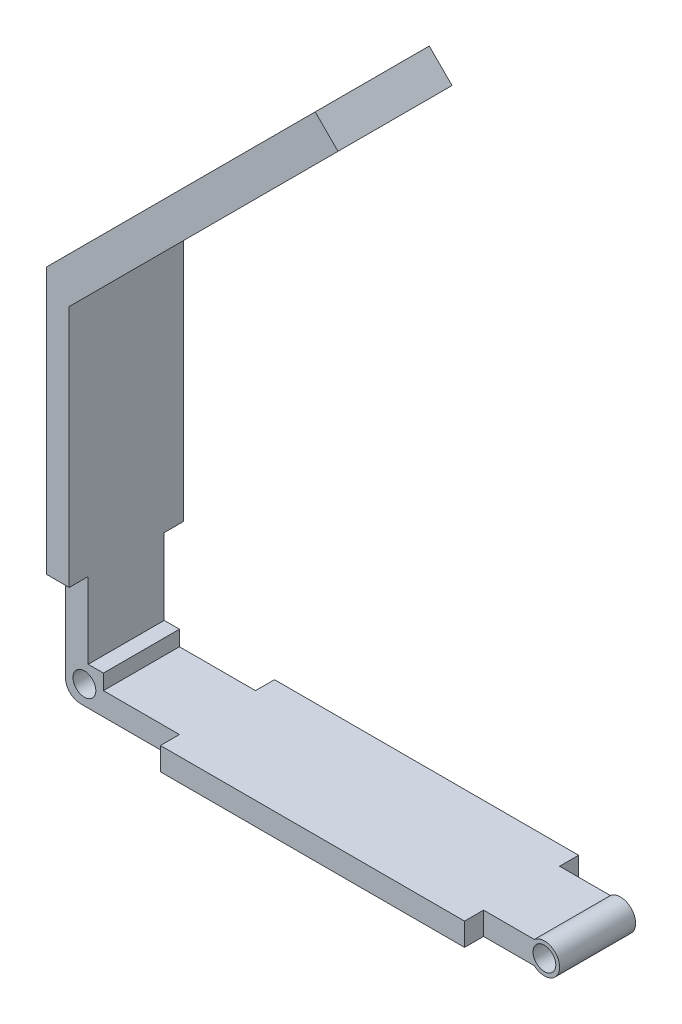
from build123d import *

# Parameters (mm, degrees)
SKETCH1_W           = 60
SKETCH1_H           = 15
BOSS_EXTRUDE1_DEPTH = 3
SKETCH2_W           = 15
SKETCH2_H           = 50
BOSS_EXTRUDE2_DEPTH = 3
SKETCH3_W           = 5
SKETCH3_H           = 5
BOSS_EXTRUDE3_DEPTH = 15
SKETCH4_R           = 1.5
CUT_EXTRUDE1_DEPTH  = 80.529868603
FILLET1_R           = 2
SKETCH5_W           = 15
SKETCH5_H           = 15
CUT_EXTRUDE2_DEPTH  = 2.5
SKETCH6_R           = 2
BOSS_EXTRUDE4_DEPTH = 15
SKETCH7_R           = 1.5
CUT_EXTRUDE3_DEPTH  = 82.049367672
SKETCH8_W           = 10
SKETCH8_H           = 4.50152391
CUT_EXTRUDE4_DEPTH  = 2.5
SKETCH11_W          = 4.242640687
SKETCH11_H          = 15
BOSS_EXTRUDE5_DEPTH = 50


with BuildPart() as part:
    # Sketch1 → Boss-Extrude1 (new body)
    with BuildSketch(Plane(origin=(0, 0, 0), x_dir=(1, 0, 0), z_dir=(0, 1, 0))):
        with Locations((30, 7.5)):
            Rectangle(SKETCH1_W, SKETCH1_H)
    extrude(amount=BOSS_EXTRUDE1_DEPTH)

    # Sketch2 → Boss-Extrude2 (add)
    with BuildSketch(Plane.ZY):
        with Locations((-7.5, 25)):
            Rectangle(SKETCH2_W, SKETCH2_H)
    extrude(amount=BOSS_EXTRUDE2_DEPTH)

    # Sketch3 → Boss-Extrude3 (add)
    with BuildSketch(Plane(origin=(0, 0, -15), x_dir=(-1, 0, 0), z_dir=(0, 0, -1))):
        with Locations((0.5, 2.5)):
            Rectangle(SKETCH3_W, SKETCH3_H)
    extrude(amount=-BOSS_EXTRUDE3_DEPTH)

    # Sketch4 → Cut-Extrude1 (cut, through all)
    with BuildSketch(Plane(origin=(0, 0, -15), x_dir=(-1, 0, 0), z_dir=(0, 0, -1))):
        with Locations((0.5, 2.5)):
            Circle(SKETCH4_R)
    extrude(amount=-CUT_EXTRUDE1_DEPTH, mode=Mode.SUBTRACT)

    # Fillet1
    fillet1_edges = [part.edges().sort_by_distance(p)[0] for p in [
        (-3, 0, -7.5),
    ]]
    fillet(fillet1_edges, radius=FILLET1_R)

    # Sketch5 → Cut-Extrude2 (cut)
    with BuildSketch(Plane(origin=(0, 0, -15), x_dir=(-1, 0, 0), z_dir=(0, 0, -1))):
        with Locations((-4.5, 7.5)):
            Rectangle(SKETCH5_W, SKETCH5_H)
    cut_extrude2 = extrude(amount=-CUT_EXTRUDE2_DEPTH, mode=Mode.SUBTRACT)

    # Mirror1: Cut-Extrude2 across plane
    add(cut_extrude2.mirror(Plane(origin=(0, 0, -7.5), x_dir=(1, 0, 0), z_dir=(0, 0, -1))), mode=Mode.SUBTRACT)

    # Sketch6 → Boss-Extrude4 (add)
    with BuildSketch(Plane(origin=(0, 0, -15), x_dir=(-1, 0, 0), z_dir=(0, 0, -1))):
        with Locations((-60, 1.5)):
            Circle(SKETCH6_R)
    extrude(amount=-BOSS_EXTRUDE4_DEPTH)

    # Sketch7 → Cut-Extrude3 (cut, through all)
    with BuildSketch(Plane(origin=(0, 0, -15), x_dir=(-1, 0, 0), z_dir=(0, 0, -1))):
        with Locations((-60, 1.5)):
            Circle(SKETCH7_R)
    extrude(amount=-CUT_EXTRUDE3_DEPTH, mode=Mode.SUBTRACT)

    # Sketch8 → Cut-Extrude4 (cut)
    with BuildSketch(Plane(origin=(0, 0, -15), x_dir=(-1, 0, 0), z_dir=(0, 0, -1))):
        with Locations((-57, 1.249238045)):
            Rectangle(SKETCH8_W, SKETCH8_H)
    cut_extrude4 = extrude(amount=-CUT_EXTRUDE4_DEPTH, mode=Mode.SUBTRACT)

    # Mirror2: Cut-Extrude4 across plane
    add(cut_extrude4.mirror(Plane(origin=(0, 0, -7.5), x_dir=(1, 0, 0), z_dir=(0, 0, -1))), mode=Mode.SUBTRACT)

    # Sketch11 → Boss-Extrude5 (add)
    with BuildSketch(Plane(origin=(23.5, 23.5, 0), x_dir=(0.7071067811865476, -0.7071067811865476, 0), z_dir=(0.7071067811865476, 0.7071067811865476, 0))):
        with Locations((-35.355339059, 7.5)):
            Rectangle(SKETCH11_W, SKETCH11_H)
    extrude(amount=BOSS_EXTRUDE5_DEPTH)


solid = part.part
